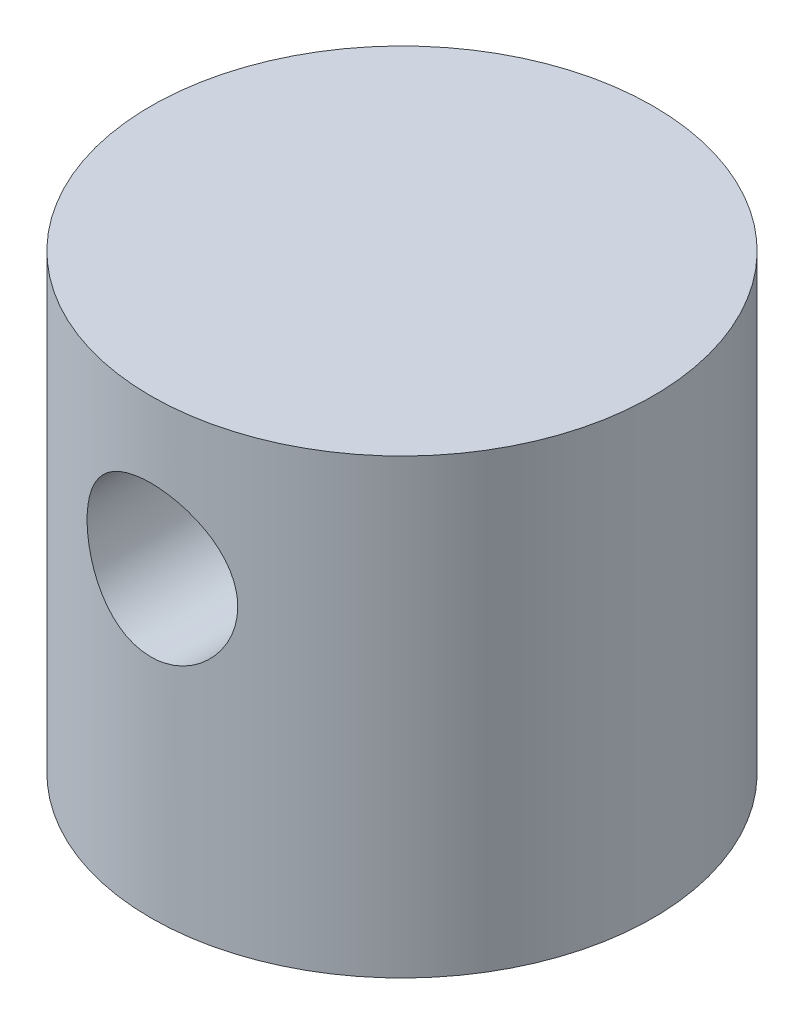
from build123d import *

# Parameters (mm, degrees)
SKETCH1_R               = 12.7
BOSS_EXTRUDE1_DEPTH     = 22.86
CUT_EXTRUDE1_DEPTH      = 30.071628781
CUT_EXTRUDE1_DEPTH_BACK = 30.071628781
SKETCH2_R               = 3.81


with BuildPart() as part:
    # Sketch1 → Boss-Extrude1 (new body)
    with BuildSketch(Plane(origin=(0, 0, 0), x_dir=(1, 0, 0), z_dir=(0, 1, 0))):
        with Locations(Location((0, 0, 0), (0, 0, 270))):
            Circle(SKETCH1_R)
    extrude(amount=BOSS_EXTRUDE1_DEPTH)

    # Sketch2 → Cut-Extrude1 (cut, two sides: drawn at the far end of the back side and taken through both)
    with BuildSketch(Plane.XY.offset(-CUT_EXTRUDE1_DEPTH_BACK)):
        with Locations(Location((0, 15.24, 0), (0, 0, 89.999999982))):
            Circle(SKETCH2_R)
    extrude(amount=CUT_EXTRUDE1_DEPTH + CUT_EXTRUDE1_DEPTH_BACK, mode=Mode.SUBTRACT)


solid = part.part
